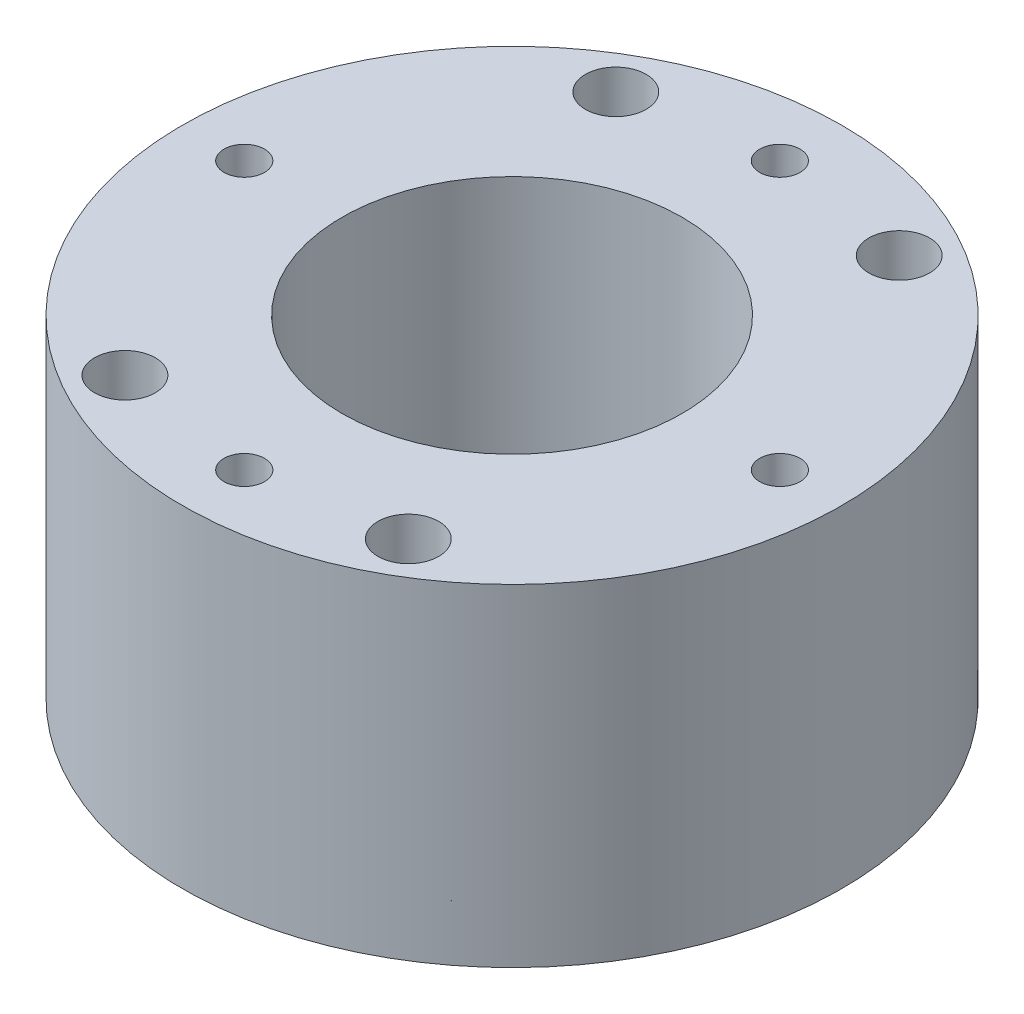
from build123d import *

# Parameters (mm, degrees)
SKETCH1_W                       = 13.4025
SKETCH1_H                       = 27.8791
CBORE_FOR_M3_SBHCS1_D           = 3.4
CBORE_FOR_M3_SBHCS1_CBORE_D     = 6.7
CBORE_FOR_M3_SBHCS1_CBORE_DEPTH = 2.15
F_10_CLEARANCE_HOLE1_D          = 5.1054


with BuildPart() as part:
    # Sketch1 → Revolve1 (revolve)
    with BuildSketch(Plane.XY, mode=Mode.PRIVATE) as revolve1_sk:
        with Locations((20.98875, 13.93955)):
            Rectangle(SKETCH1_W, SKETCH1_H)
    revolve(revolve1_sk.sketch.rotate(Axis((0, 0, 0), (0, 1, 0)), 90), axis=Axis((0, 0, 0), (0, 1, 0)))

    # CBORE for M3 SBHCS1 (through all)
    with Locations(Plane.XZ):
        with Locations((0, 22.5), (0, -22.5), (22.5, 0), (-22.5, 0)):
            CounterBoreHole(CBORE_FOR_M3_SBHCS1_D / 2, CBORE_FOR_M3_SBHCS1_CBORE_D / 2, CBORE_FOR_M3_SBHCS1_CBORE_DEPTH)

    # #10 Clearance Hole1 (through all)
    with Locations(Plane.XZ):
        with Locations((-11.90625, 20.622229928), (-11.90625, -20.622229928), (11.90625, -20.622229928), (11.90625, 20.622229928)):
            Hole(F_10_CLEARANCE_HOLE1_D / 2)


solid = part.part
